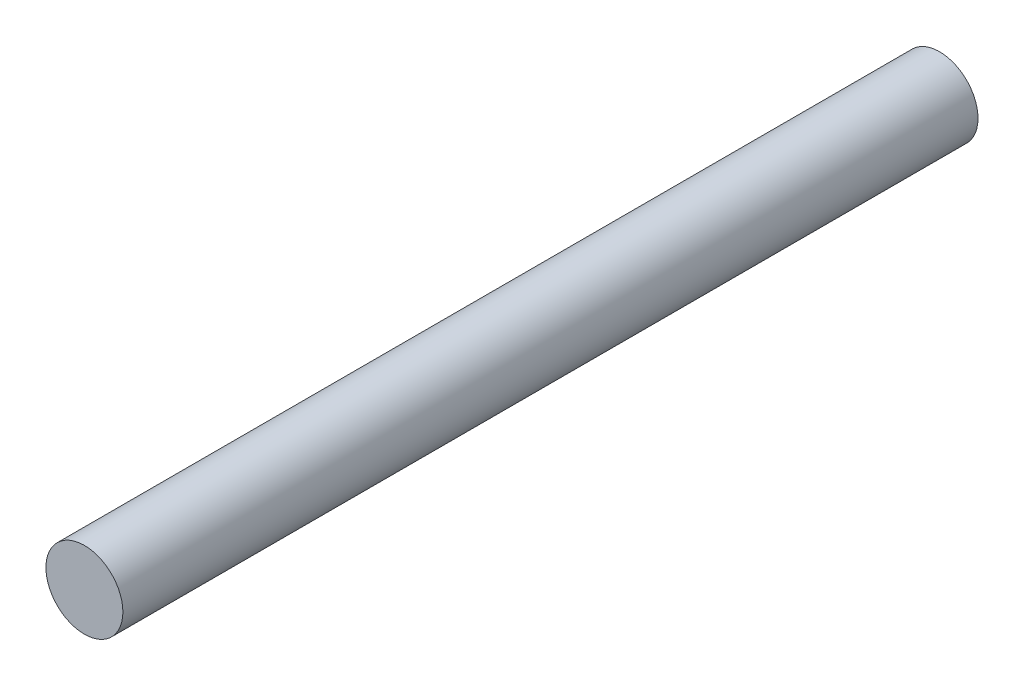
from build123d import *

# Parameters (mm, degrees)
SKETCH1_R           = 1
BOSS_EXTRUDE1_DEPTH = 22.225


with BuildPart() as part:
    # Sketch1 → Boss-Extrude1 (new body)
    with BuildSketch(Plane.XY):
        Circle(SKETCH1_R)
    extrude(amount=-BOSS_EXTRUDE1_DEPTH)


solid = part.part
